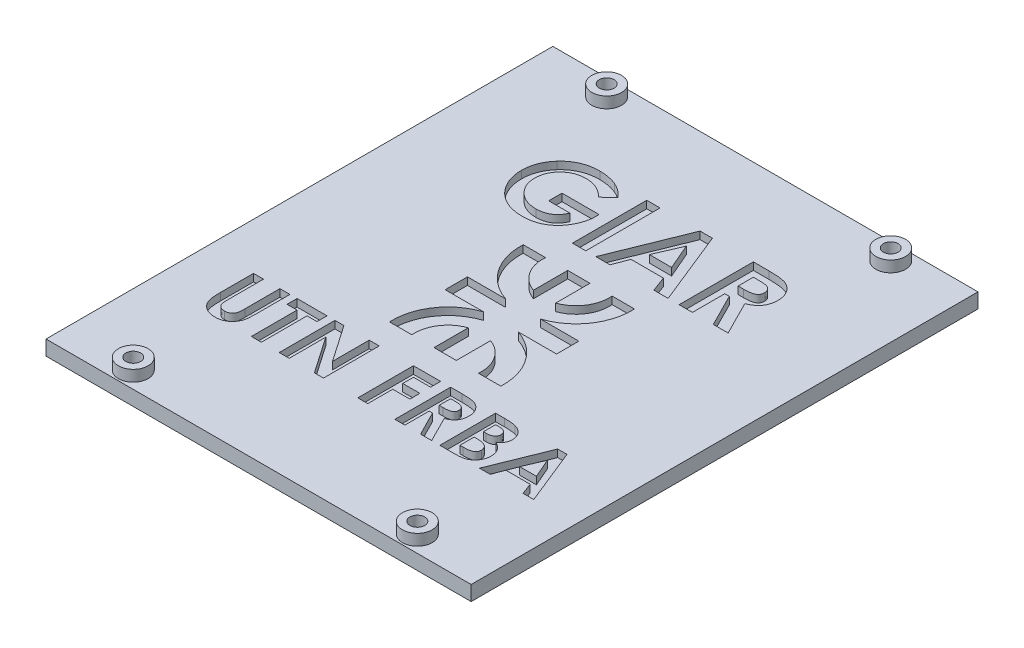
from build123d import *

# Parameters (mm, degrees)
SKETCH2_W           = 114.5
SKETCH2_H           = 136.5
SKETCH2_R           = 2
BOSS_EXTRUDE1_DEPTH = 4
CUT_EXTRUDE1_DEPTH  = 2
SKETCH4_W           = 3.58974359
SKETCH4_H           = 20
CUT_EXTRUDE2_DEPTH  = 2
SKETCH5_R           = 4
SKETCH5_R_2         = 2
BOSS_EXTRUDE2_DEPTH = 3


with BuildPart() as part:
    # Sketch2 → Boss-Extrude1 (new body)
    with BuildSketch(Plane(origin=(0, 0, 0), x_dir=(1, 0, 0), z_dir=(0, 1, 0))):
        Rectangle(SKETCH2_W, SKETCH2_H)
        with Locations(Location((-38.25, 63.75, 0), (0, 0, 270))):
            Circle(SKETCH2_R, mode=Mode.SUBTRACT)
        with Locations(Location((-38.25, -63.75, 0), (0, 0, 90))):
            Circle(SKETCH2_R, mode=Mode.SUBTRACT)
        with Locations(Location((38.25, -63.75, 0), (0, 0, 270))):
            Circle(SKETCH2_R, mode=Mode.SUBTRACT)
        with Locations(Location((38.25, 63.75, 0), (0, 0, 90))):
            Circle(SKETCH2_R, mode=Mode.SUBTRACT)
    extrude(amount=BOSS_EXTRUDE1_DEPTH)

    # Sketch3 → Cut-Extrude1 (cut)
    with BuildSketch(Plane(origin=(0, 4, 0), x_dir=(1, 0, 0), z_dir=(0, 1, 0))):
        with BuildLine():
            Line((-15, -3), (-4.683748499, -3))
            ThreePointArc((-4.683748499, -3), (-12.36640312, -8.760472694), (-14.981238267, -18))
            Line((-14.981238267, -18), (-8.968695557, -18))
            ThreePointArc((-8.968695557, -18), (-7.558771319, -12.364820766), (-3, -8.764718626))
            Line((-3, -8.764718626), (-3, -18))
            Line((-3, -18), (3, -18))
            Line((3, -18), (3, -8.764718626))
            ThreePointArc((3, -8.764718626), (7.558771319, -12.364820766), (8.968695557, -18))
            Line((8.968695557, -18), (14.981238267, -18))
            ThreePointArc((14.981238267, -18), (12.36640312, -8.760472694), (4.683748499, -3))
            Line((4.683748499, -3), (15, -3))
            Line((15, -3), (15, 3))
            Line((15, 3), (4.683748499, 3))
            ThreePointArc((4.683748499, 3), (12.36640312, 8.760472694), (14.981238267, 18))
            Line((14.981238267, 18), (8.968695557, 18))
            ThreePointArc((8.968695557, 18), (7.558771319, 12.364820766), (3, 8.764718626))
            Line((3, 8.764718626), (3, 18))
            Line((3, 18), (-3, 18))
            Line((-3, 18), (-3, 8.764718626))
            ThreePointArc((-3, 8.764718626), (-7.558771319, 12.364820766), (-8.968695557, 18))
            Line((-8.968695557, 18), (-14.981238267, 18))
            ThreePointArc((-14.981238267, 18), (-12.36640312, 8.760472694), (-4.683748499, 3))
            Line((-4.683748499, 3), (-15, 3))
            Line((-15, 3), (-15, -3))
        make_face()
    extrude(amount=-CUT_EXTRUDE1_DEPTH, mode=Mode.SUBTRACT)

    # Sketch4 → Cut-Extrude2 (cut)
    # profile 1 of 11: a face of its own
    with BuildSketch(Plane(origin=(0, 4, 4), x_dir=(1, 0, 0), z_dir=(0, 1, 0))):
        with BuildLine():
            Line((-13.209134615, 45.818910256), (-15.925480769, 43.21875))
            add(Edge.make_bspline(
                [(-15.925480769, 43.21875), (-16.140538634, 43.434065542), (-16.56251767, 43.856550183), (-17.252611595, 44.406442978), (-17.967339464, 44.873960563), (-18.709053733, 45.258386223), (-19.478787615, 45.556580188), (-20.275022094, 45.769887872), (-21.099052543, 45.896404274), (-21.656884374, 45.914116139), (-21.939102564, 45.923076923)],
                knots=[0, 0, 0, 0, 1.075575784, 2.110457258, 3.113929901, 4.09197124, 5.059417775, 6.02750972, 7.002078037, 8, 8, 8, 8], degree=3))
            add(Edge.make_bspline(
                [(-21.939102564, 45.923076923), (-22.183777106, 45.916798142), (-22.664217018, 45.904469206), (-23.370177196, 45.810844105), (-24.04476539, 45.654447585), (-24.691168634, 45.43778632), (-25.305440412, 45.155841537), (-25.891139928, 44.812964722), (-26.444662783, 44.40653284), (-26.961650383, 43.944250426), (-27.432369257, 43.439531365), (-27.843331689, 42.899303498), (-28.193383392, 42.333636215), (-28.481547336, 41.739635478), (-28.700808761, 41.11821296), (-28.857332726, 40.469819783), (-28.956686522, 39.796340266), (-28.968417237, 39.336885564), (-28.974358974, 39.104166667)],
                knots=[0, 0, 0, 0, 1.075001177, 2.110859044, 3.123021556, 4.114053297, 5.101481495, 6.087880186, 7.091499647, 8.114004866, 9.131394192, 10.11971144, 11.092043119, 12.050101265, 13.015322563, 13.981809771, 14.977764287, 16, 16, 16, 16], degree=3))
            add(Edge.make_bspline(
                [(-28.974358974, 39.104166667), (-28.968816806, 38.863393056), (-28.957897976, 38.389036082), (-28.853010267, 37.692896831), (-28.691412693, 37.023160707), (-28.454876933, 36.384796998), (-28.163773046, 35.769061012), (-27.794605356, 35.187880141), (-27.364118887, 34.632379115), (-26.873082857, 34.112229527), (-26.338962464, 33.632776788), (-25.760492701, 33.219188514), (-25.155274163, 32.862351109), (-24.513538596, 32.57974742), (-23.846424631, 32.352847616), (-23.147165815, 32.192863783), (-22.41733671, 32.094714256), (-21.919380892, 32.082912505), (-21.666666667, 32.076923077)],
                knots=[0, 0, 0, 0, 1.022067601, 2.013613092, 2.983553406, 3.943623673, 4.90013463, 5.87121881, 6.861774014, 7.881098904, 8.905697761, 9.905387765, 10.89678721, 11.884561068, 12.87834324, 13.885584958, 14.926927371, 16, 16, 16, 16], degree=3))
            add(Edge.make_bspline(
                [(-21.666666667, 32.076923077), (-21.502285422, 32.07840626), (-21.179568462, 32.08131808), (-20.706197677, 32.128585096), (-20.252822164, 32.19615879), (-19.817686125, 32.285618337), (-19.405183266, 32.412219649), (-19.009602202, 32.560264294), (-18.63326069, 32.734986493), (-18.278199215, 32.942414489), (-17.939133432, 33.174915917), (-17.619237062, 33.440946992), (-17.312898747, 33.734509694), (-17.02369801, 34.059190303), (-16.75652966, 34.417891852), (-16.502834297, 34.804022719), (-16.265516693, 35.221415018), (-16.125291982, 35.516156317), (-16.053685897, 35.666666667)],
                knots=[0, 0, 0, 0, 1.109579412, 2.178351274, 3.208885622, 4.204702371, 5.174744997, 6.119429583, 7.05542196, 7.97267548, 8.893247984, 9.828544973, 10.778894627, 11.756245826, 12.760884819, 13.796418446, 14.874735809, 16, 16, 16, 16], degree=3))
            Line((-16.053685897, 35.666666667), (-21.794871795, 35.666666667))
            Line((-21.794871795, 35.666666667), (-21.794871795, 39.256410256))
            Line((-21.794871795, 39.256410256), (-11.822916667, 39.256410256))
            Line((-11.822916667, 39.256410256), (-11.794871795, 38.403044872))
            add(Edge.make_bspline(
                [(-11.794871795, 38.403044872), (-11.798475352, 38.183878989), (-11.805676036, 37.745938343), (-11.871482733, 37.093919328), (-11.980490525, 36.450547993), (-12.129514611, 35.816470524), (-12.316279489, 35.188576544), (-12.554463172, 34.572878661), (-12.833374809, 33.965201415), (-13.14587551, 33.368126966), (-13.497036385, 32.795217798), (-13.875112629, 32.252748445), (-14.274714507, 31.741657803), (-14.704533196, 31.269066647), (-15.157875711, 30.831005), (-15.635634462, 30.42915814), (-16.139499256, 30.063186054), (-16.666800922, 29.729997114), (-17.22054295, 29.437976667), (-17.797680867, 29.183957618), (-18.397343275, 28.968224603), (-19.021078359, 28.791370462), (-19.667658767, 28.654913422), (-20.337098348, 28.56134465), (-21.029764767, 28.497763619), (-21.499585747, 28.490750183), (-21.738782051, 28.487179487)],
                knots=[0, 0, 0, 0, 1.006889344, 2.011981806, 3.007738725, 4.003571281, 5.003404394, 6.015442001, 7.03424805, 8.074616296, 9.110249922, 10.119753985, 11.111721717, 12.089233633, 13.052717867, 14.006597561, 14.955430184, 15.912305663, 16.870361111, 17.829300583, 18.807640451, 19.796414044, 20.806216501, 21.841577364, 22.90109906, 24, 24, 24, 24], degree=3))
            add(Edge.make_bspline(
                [(-21.738782051, 28.487179487), (-21.99398829, 28.490705616), (-22.499883174, 28.497695454), (-23.247916563, 28.563160047), (-23.974249037, 28.671205132), (-24.679061761, 28.820735838), (-25.363991169, 29.006838746), (-26.027860445, 29.240441918), (-26.669311799, 29.518320278), (-27.290266076, 29.833115501), (-27.882786803, 30.190120704), (-28.445546048, 30.583075759), (-28.975472162, 31.014508365), (-29.477993232, 31.47719625), (-29.941368425, 31.982512324), (-30.382865921, 32.514076841), (-30.781096678, 33.091385468), (-31.153183438, 33.695721691), (-31.483748288, 34.326832259), (-31.772832002, 34.973044458), (-32.019362429, 35.630616715), (-32.21375763, 36.302610909), (-32.371588328, 36.984341331), (-32.484519153, 37.678772671), (-32.548296467, 38.385818001), (-32.558810475, 38.860989088), (-32.564102564, 39.100160256)],
                knots=[0, 0, 0, 0, 1.084149091, 2.14910686, 3.187506334, 4.202448172, 5.208724393, 6.201130722, 7.189831603, 8.176984443, 9.156919086, 10.126598231, 11.090766514, 12.05840148, 13.026036446, 14.001772938, 14.991905635, 16.003017641, 17.015720547, 18.016462227, 19.009322657, 19.99686681, 20.986544154, 21.980959929, 22.983742515, 24, 24, 24, 24], degree=3))
            add(Edge.make_bspline(
                [(-32.564102564, 39.100160256), (-32.557015327, 39.42644084), (-32.543020135, 40.070748258), (-32.41340342, 41.019817171), (-32.211350272, 41.937946648), (-31.921383662, 42.821792922), (-31.549288027, 43.672573502), (-31.10033444, 44.492285636), (-30.564770654, 45.280058041), (-30.1502075, 45.76779857), (-29.939903846, 46.015224359)],
                knots=[0, 0, 0, 0, 1.034044851, 2.041932006, 3.031217818, 4.011390712, 4.986069675, 5.97149666, 6.970960976, 8, 8, 8, 8], degree=3))
            add(Edge.make_bspline(
                [(-29.939903846, 46.015224359), (-29.809328362, 46.158367677), (-29.550137991, 46.442505011), (-29.135822654, 46.837319617), (-28.711000164, 47.208459953), (-28.269786662, 47.548056221), (-27.814501525, 47.863542347), (-27.343834363, 48.149004292), (-26.860254187, 48.413531314), (-26.359989657, 48.643615663), (-25.845659727, 48.849905474), (-25.314986511, 49.02445566), (-24.771944641, 49.179065637), (-24.211725465, 49.296684175), (-23.639988532, 49.394627918), (-23.052675462, 49.460274943), (-22.451386719, 49.50838954), (-22.044705255, 49.511331839), (-21.838942308, 49.512820513)],
                knots=[0, 0, 0, 0, 1.020590567, 2.025856924, 3.013483481, 3.991664875, 4.957826714, 5.930500614, 6.890802512, 7.860442893, 8.829981142, 9.809047939, 10.802672283, 11.803273349, 12.823572789, 13.857849586, 14.916166035, 16, 16, 16, 16], degree=3))
            add(Edge.make_bspline(
                [(-21.838942308, 49.512820513), (-21.623853223, 49.509503469), (-21.195904924, 49.50290377), (-20.559616672, 49.457238161), (-19.932170072, 49.38678689), (-19.316209245, 49.28110596), (-18.709667024, 49.150779378), (-18.115683016, 48.983798769), (-17.530382211, 48.794078719), (-17.149353604, 48.642819879), (-16.959134615, 48.567307692)],
                knots=[0, 0, 0, 0, 1.03180557, 2.052914215, 3.058998889, 4.059601663, 5.049854447, 6.033765722, 7.018406786, 8, 8, 8, 8], degree=3))
            add(Edge.make_bspline(
                [(-16.959134615, 48.567307692), (-16.799088867, 48.497520839), (-16.473560242, 48.355576311), (-15.999956214, 48.095882139), (-15.525195042, 47.807981343), (-15.05439964, 47.481347603), (-14.588287368, 47.116591875), (-14.121991519, 46.719475414), (-13.660272207, 46.285367615), (-13.36146133, 45.976409693), (-13.209134615, 45.818910256)],
                knots=[0, 0, 0, 0, 0.894392155, 1.819168899, 2.76525314, 3.739198753, 4.75366411, 5.797420238, 6.877176959, 8, 8, 8, 8], degree=3))
        make_face()
    # profile 2 of 11: a face of its own
    with BuildSketch(Plane(origin=(0, 4, 4), x_dir=(1, 0, 0), z_dir=(0, 1, 0))):
        with Locations((-6.923076923, 39)):
            Rectangle(SKETCH4_W, SKETCH4_H)
    # profile 3 of 11: a face of its own
    with BuildSketch(Plane(origin=(0, 4, 4), x_dir=(1, 0, 0), z_dir=(0, 1, 0))):
        Polygon((5.645032051, 49), (8.974358974, 49), (17.051282051, 29), (13.217147436, 29), (11.662660256, 33.102564103), (2.948717949, 33.102564103), (1.394230769, 29), (-2.435897436, 29), align=None)
        Polygon((7.307692308, 43.635416667), (4.310897436, 36.692307692), (10.304487179, 36.692307692), align=None, mode=Mode.SUBTRACT)
    # profile 4 of 11: a face of its own
    with BuildSketch(Plane(origin=(0, 4, 4), x_dir=(1, 0, 0), z_dir=(0, 1, 0))):
        with BuildLine():
            Line((20, 49), (24.182692308, 49))
            add(Edge.make_bspline(
                [(24.182692308, 49), (24.459166996, 48.999018674), (24.990905701, 48.997131306), (25.757643869, 48.967353651), (26.461998321, 48.925915599), (27.105011916, 48.862680033), (27.686409563, 48.778837315), (28.206773958, 48.680000625), (28.666089891, 48.567355027), (29.068231057, 48.426989724), (29.431143575, 48.26865979), (29.769428495, 48.086735793), (30.090548888, 47.883243514), (30.392358409, 47.65282852), (30.677479855, 47.399635921), (30.946451123, 47.123410852), (31.195471402, 46.821811039), (31.422998747, 46.496742211), (31.630371606, 46.154777258), (31.813645721, 45.79544666), (31.962684536, 45.418500527), (32.094376305, 45.029386545), (32.18922962, 44.622542253), (32.255198713, 44.201928349), (32.303498702, 43.766064229), (32.306275721, 43.469957497), (32.307692308, 43.318910256)],
                knots=[0, 0, 0, 0, 1.749336639, 3.364467119, 4.854658419, 6.213483162, 7.451590619, 8.570285859, 9.5643256, 10.440900261, 11.26203566, 12.067320669, 12.869050712, 13.665104639, 14.467235401, 15.27997916, 16.102287765, 16.939272006, 17.78853747, 18.631303466, 19.488103222, 20.351255419, 21.228522269, 22.127379805, 23.044756219, 24, 24, 24, 24], degree=3))
            add(Edge.make_bspline(
                [(32.307692308, 43.318910256), (32.304012524, 43.161251636), (32.296797138, 42.852111816), (32.257931147, 42.398010633), (32.186896323, 41.963558385), (32.079303748, 41.550027093), (31.955640059, 41.15226988), (31.791199073, 40.777625613), (31.605611168, 40.420645635), (31.385193836, 40.086379564), (31.143296581, 39.767402681), (30.861975163, 39.475936175), (30.559454887, 39.196314824), (30.218729988, 38.946053162), (29.854819935, 38.708229398), (29.460494218, 38.492697733), (29.038326343, 38.294040198), (28.741521419, 38.183255033), (28.58974359, 38.126602564)],
                knots=[0, 0, 0, 0, 1.099860209, 2.156625411, 3.176576793, 4.16617041, 5.135385252, 6.078461593, 7.016046972, 7.938469504, 8.868247731, 9.803980173, 10.76021508, 11.73834243, 12.748633912, 13.790971185, 14.870363756, 16, 16, 16, 16], degree=3))
            Line((28.58974359, 38.126602564), (33.205128205, 29))
            Line((33.205128205, 29), (29.21474359, 29))
            Line((29.21474359, 29), (24.807692308, 37.717948718))
            Line((24.807692308, 37.717948718), (23.58974359, 37.717948718))
            Line((23.58974359, 37.717948718), (23.58974359, 29))
            Line((23.58974359, 29), (20, 29))
            Line((20, 29), (20, 49))
        make_face()
        with BuildLine():
            Line((23.58974359, 41.307692308), (24.987980769, 41.307692308))
            add(Edge.make_bspline(
                [(24.987980769, 41.307692308), (25.158926887, 41.309617618), (25.486251972, 41.313304173), (25.956988434, 41.330403944), (26.384529407, 41.371605941), (26.770710895, 41.423663125), (27.117476128, 41.483770662), (27.421732084, 41.569908412), (27.688166881, 41.662207191), (27.913623258, 41.776910631), (28.106248006, 41.907353321), (28.272567146, 42.055539459), (28.410136923, 42.227046045), (28.523363867, 42.41721227), (28.611442118, 42.627720107), (28.675732495, 42.856258656), (28.711661308, 43.105431267), (28.71579504, 43.277394297), (28.717948718, 43.366987179)],
                knots=[0, 0, 0, 0, 1.688639943, 3.233382647, 4.650958383, 5.928841754, 7.082724185, 8.122798841, 9.049171256, 9.863274652, 10.613301712, 11.341792392, 12.054588806, 12.776240173, 13.521029143, 14.301969904, 15.115324896, 16, 16, 16, 16], degree=3))
            add(Edge.make_bspline(
                [(28.717948718, 43.366987179), (28.713876992, 43.4729821), (28.705878842, 43.68118948), (28.626512342, 43.980935101), (28.500178018, 44.258370181), (28.327008262, 44.5122412), (28.108923468, 44.73480206), (27.858653961, 44.930991231), (27.57079832, 45.086122947), (27.304265658, 45.188446176), (27.061783235, 45.249667219), (26.842950499, 45.295288599), (26.589540873, 45.327621781), (26.301363046, 45.361916875), (25.979151595, 45.384155508), (25.621150273, 45.400385277), (25.228387258, 45.407025673), (24.954594133, 45.40914849), (24.811698718, 45.41025641)],
                knots=[0, 0, 0, 0, 1.020303359, 2.004196876, 2.966617323, 3.9489082, 4.950758222, 5.960522915, 7.003732012, 8.091992268, 8.70421221, 9.413913587, 10.24622431, 11.166358409, 12.212345909, 13.359657661, 14.621978493, 16, 16, 16, 16], degree=3))
            Line((24.811698718, 45.41025641), (23.58974359, 45.41025641))
            Line((23.58974359, 45.41025641), (23.58974359, 41.307692308))
        make_face(mode=Mode.SUBTRACT)
    # profile 5 of 11: a face of its own
    with BuildSketch(Plane(origin=(0, 4, 4), x_dir=(1, 0, 0), z_dir=(0, 1, 0))):
        with BuildLine():
            Line((-44.615384615, -21), (-41.923076923, -21))
            Line((-41.923076923, -21), (-41.923076923, -30.759615385))
            add(Edge.make_bspline(
                [(-41.923076923, -30.759615385), (-41.922930529, -30.860798844), (-41.922647769, -31.05623365), (-41.908492692, -31.336618611), (-41.895539819, -31.594351096), (-41.872169161, -31.829148944), (-41.837642689, -32.041112593), (-41.804209797, -32.231603621), (-41.758961684, -32.397211503), (-41.690961005, -32.58571663), (-41.586194281, -32.797512436), (-41.415011267, -33.018250884), (-41.217480713, -33.219706757), (-40.980728967, -33.387390993), (-40.714640942, -33.523032425), (-40.420678674, -33.623527716), (-40.099256544, -33.679389754), (-39.877010773, -33.687918117), (-39.762620192, -33.692307692)],
                knots=[0, 0, 0, 0, 1.155499968, 2.231836252, 3.205919964, 4.102923608, 4.924856345, 5.658536265, 6.31071849, 6.882491295, 7.94666036, 8.992281882, 10.060072772, 11.158554251, 12.289267114, 13.461410017, 14.693379945, 16, 16, 16, 16], degree=3))
            add(Edge.make_bspline(
                [(-39.762620192, -33.692307692), (-39.641094317, -33.688761479), (-39.404139435, -33.681846965), (-39.063317559, -33.613973516), (-38.747544159, -33.505895741), (-38.463505233, -33.351641212), (-38.211483447, -33.166740125), (-37.998152286, -32.955894944), (-37.829792117, -32.718685137), (-37.720061222, -32.499841026), (-37.658452729, -32.29841408), (-37.612274094, -32.118446747), (-37.578420046, -31.906103108), (-37.547706541, -31.664699367), (-37.529250091, -31.391735046), (-37.509237079, -31.08940536), (-37.501902125, -30.755641688), (-37.500651935, -30.523235779), (-37.5, -30.402043269)],
                knots=[0, 0, 0, 0, 1.261321664, 2.459363699, 3.594844139, 4.716940403, 5.803436589, 6.833651888, 7.818396249, 8.814403945, 9.360733334, 10.004355033, 10.743453831, 11.592799886, 12.532235708, 13.585170094, 14.740740724, 16, 16, 16, 16], degree=3))
            Line((-37.5, -30.402043269), (-37.5, -21))
            Line((-37.5, -21), (-34.807692308, -21))
            Line((-34.807692308, -21), (-34.807692308, -29.948317308))
            add(Edge.make_bspline(
                [(-34.807692308, -29.948317308), (-34.808066184, -30.129609789), (-34.80878511, -30.478217549), (-34.819825659, -30.979191432), (-34.843328989, -31.436750715), (-34.863069076, -31.851029095), (-34.901272904, -32.22146847), (-34.94107233, -32.549650723), (-34.991800123, -32.834412849), (-35.067280028, -33.158579924), (-35.197535999, -33.531846438), (-35.407525702, -33.961646649), (-35.674094038, -34.382447089), (-35.989164489, -34.789618665), (-36.344907848, -35.167867936), (-36.733436525, -35.499921837), (-37.148577763, -35.78080363), (-37.594669492, -36.003645418), (-38.071332064, -36.177445213), (-38.5832817, -36.294229921), (-39.130169291, -36.373131136), (-39.507914887, -36.380710569), (-39.702524038, -36.384615385)],
                knots=[0, 0, 0, 0, 1.170808336, 2.251350247, 3.235597562, 4.129743112, 4.929140599, 5.639994148, 6.264258765, 6.79612947, 7.788252245, 8.809469599, 9.879094798, 10.999557536, 12.129761673, 13.226370002, 14.293821979, 15.358369427, 16.438775801, 17.562147481, 18.744053101, 20, 20, 20, 20], degree=3))
            add(Edge.make_bspline(
                [(-39.702524038, -36.384615385), (-39.83182623, -36.38243746), (-40.086936802, -36.378140459), (-40.462121652, -36.340252138), (-40.824811509, -36.284418998), (-41.174324884, -36.202964198), (-41.51187487, -36.097739809), (-41.837371789, -35.968215915), (-42.149606016, -35.815114982), (-42.446830332, -35.63984521), (-42.728678977, -35.450321122), (-42.98627409, -35.240225693), (-43.228480123, -35.025096273), (-43.448299844, -34.795879302), (-43.647384297, -34.554981168), (-43.825323466, -34.301855917), (-43.981852993, -34.036526032), (-44.120910292, -33.754208959), (-44.239929768, -33.440555538), (-44.340267658, -33.084408988), (-44.427925199, -32.680187069), (-44.493067112, -32.22697909), (-44.552125152, -31.726278773), (-44.589505635, -31.176781719), (-44.609061049, -30.57847216), (-44.613223498, -30.163676547), (-44.615384615, -29.948317308)],
                knots=[0, 0, 0, 0, 1.001158378, 1.975264943, 2.917723546, 3.841610987, 4.75185031, 5.653588123, 6.552117133, 7.442167995, 8.324307438, 9.179605724, 10.014504199, 10.831958861, 11.636465792, 12.43274043, 13.225645099, 14.020104002, 14.867201867, 15.819789774, 16.883317127, 18.068162734, 19.364263498, 20.787406516, 22.332041935, 24, 24, 24, 24], degree=3))
            Line((-44.615384615, -29.948317308), (-44.615384615, -21))
        make_face()
    # profile 6 of 11: a face of its own
    with BuildSketch(Plane(origin=(0, 4, 4), x_dir=(1, 0, 0), z_dir=(0, 1, 0))):
        Polygon((-32.884615385, -21), (-24.807692308, -21), (-24.807692308, -23.692307692), (-27.5, -23.692307692), (-27.5, -36), (-30.192307692, -36), (-30.192307692, -23.692307692), (-32.884615385, -23.692307692), align=None)
    # profile 7 of 11: a face of its own
    with BuildSketch(Plane(origin=(0, 4, 4), x_dir=(1, 0, 0), z_dir=(0, 1, 0))):
        Polygon((-22.692307692, -21), (-20.267427885, -21), (-13.461538462, -30.870793269), (-13.461538462, -21), (-10.769230769, -21), (-10.769230769, -36), (-13.212139423, -36), (-20, -26.159254808), (-20, -36), (-22.692307692, -36), align=None)
    # profile 8 of 11: a face of its own
    with BuildSketch(Plane(origin=(0, 4, 4), x_dir=(1, 0, 0), z_dir=(0, 1, 0))):
        Polygon((-1.538461538, -21), (5.769230769, -21), (5.769230769, -23.692307692), (1.153846154, -23.692307692), (1.153846154, -26.576923077), (5.769230769, -26.576923077), (5.769230769, -29.269230769), (1.153846154, -29.269230769), (1.153846154, -36), (-1.538461538, -36), align=None)
    # profile 9 of 11: a face of its own
    with BuildSketch(Plane(origin=(0, 4, 4), x_dir=(1, 0, 0), z_dir=(0, 1, 0))):
        with BuildLine():
            Line((8.461538462, -21), (11.598557692, -21))
            add(Edge.make_bspline(
                [(11.598557692, -21), (11.805913709, -21.000735995), (12.204717737, -21.00215152), (12.779771364, -21.024484762), (13.308037202, -21.055563301), (13.790297399, -21.102989976), (14.226345634, -21.165872014), (14.61661893, -21.239999531), (14.961105879, -21.32448373), (15.262711754, -21.429757707), (15.534896143, -21.548505157), (15.788609833, -21.684948155), (16.029450127, -21.837567365), (16.255807268, -22.01037861), (16.469648353, -22.20027306), (16.671376804, -22.407441861), (16.858142013, -22.63364172), (17.028787521, -22.877443342), (17.184317166, -23.133917056), (17.321772752, -23.403415005), (17.433551863, -23.686124605), (17.53232069, -23.977960092), (17.603460676, -24.28309331), (17.652937496, -24.598553738), (17.689162488, -24.925451828), (17.691245252, -25.147531877), (17.692307692, -25.260817308)],
                knots=[0, 0, 0, 0, 1.749336639, 3.364467119, 4.854658419, 6.213483162, 7.451590619, 8.570285859, 9.5643256, 10.440900261, 11.26203566, 12.067320669, 12.869050712, 13.665104639, 14.467235401, 15.27997916, 16.102287765, 16.939272006, 17.78853747, 18.631303466, 19.488103222, 20.351255419, 21.228522269, 22.127379805, 23.044756219, 24, 24, 24, 24], degree=3))
            add(Edge.make_bspline(
                [(17.692307692, -25.260817308), (17.689547854, -25.379061273), (17.684136315, -25.610916138), (17.654986822, -25.951492025), (17.601710704, -26.277331211), (17.521016273, -26.58747968), (17.428268506, -26.88579759), (17.304937766, -27.16678079), (17.165746838, -27.434515774), (17.000433838, -27.685215327), (16.819010897, -27.924447989), (16.608019834, -28.143047869), (16.381129627, -28.352763882), (16.125585952, -28.540460129), (15.852653413, -28.718827951), (15.556909125, -28.8804767), (15.240283219, -29.029469852), (15.017679526, -29.112558725), (14.903846154, -29.155048077)],
                knots=[0, 0, 0, 0, 1.099860209, 2.156625411, 3.176576793, 4.16617041, 5.135385252, 6.078461593, 7.016046972, 7.938469504, 8.868247731, 9.803980173, 10.76021508, 11.73834243, 12.748633912, 13.790971185, 14.870363756, 16, 16, 16, 16], degree=3))
            Line((14.903846154, -29.155048077), (18.365384615, -36))
            Line((18.365384615, -36), (15.372596154, -36))
            Line((15.372596154, -36), (12.067307692, -29.461538462))
            Line((12.067307692, -29.461538462), (11.153846154, -29.461538462))
            Line((11.153846154, -29.461538462), (11.153846154, -36))
            Line((11.153846154, -36), (8.461538462, -36))
            Line((8.461538462, -36), (8.461538462, -21))
        make_face()
        with BuildLine():
            Line((11.153846154, -26.769230769), (12.202524038, -26.769230769))
            add(Edge.make_bspline(
                [(12.202524038, -26.769230769), (12.330733627, -26.767786787), (12.57622744, -26.76502187), (12.929279787, -26.752197042), (13.249935517, -26.721295544), (13.539571633, -26.682252656), (13.799645558, -26.637172003), (14.027837524, -26.572568691), (14.227663622, -26.503344607), (14.396755905, -26.417317026), (14.541224466, -26.319485009), (14.665963821, -26.208345406), (14.769141154, -26.079715466), (14.854061362, -25.937090798), (14.92012005, -25.77920992), (14.968337832, -25.607806008), (14.995284442, -25.42092655), (14.998384741, -25.291954277), (15, -25.224759615)],
                knots=[0, 0, 0, 0, 1.688639943, 3.233382647, 4.650958383, 5.928841754, 7.082724185, 8.122798841, 9.049171256, 9.863274652, 10.613301712, 11.341792392, 12.054588806, 12.776240173, 13.521029143, 14.301969904, 15.115324896, 16, 16, 16, 16], degree=3))
            add(Edge.make_bspline(
                [(15, -25.224759615), (14.996946206, -25.145263425), (14.990947593, -24.98910789), (14.931422718, -24.764298675), (14.836671975, -24.556222365), (14.706794658, -24.3658191), (14.543231063, -24.198898455), (14.355528932, -24.051756577), (14.139637202, -23.935407789), (13.939737705, -23.858665368), (13.757875888, -23.812749586), (13.593751336, -23.778533551), (13.403694116, -23.754283665), (13.187560746, -23.728562344), (12.945902158, -23.711883369), (12.677401166, -23.699711042), (12.382828905, -23.694730746), (12.177484061, -23.693138632), (12.0703125, -23.692307692)],
                knots=[0, 0, 0, 0, 1.020303359, 2.004196876, 2.966617323, 3.9489082, 4.950758222, 5.960522915, 7.003732012, 8.091992268, 8.70421221, 9.413913587, 10.24622431, 11.166358409, 12.212345909, 13.359657661, 14.621978493, 16, 16, 16, 16], degree=3))
            Line((12.0703125, -23.692307692), (11.153846154, -23.692307692))
            Line((11.153846154, -23.692307692), (11.153846154, -26.769230769))
        make_face(mode=Mode.SUBTRACT)
    # profile 10 of 11: a face of its own
    with BuildSketch(Plane(origin=(0, 4, 4), x_dir=(1, 0, 0), z_dir=(0, 1, 0))):
        with BuildLine():
            Line((20.576923077, -36), (20.576923077, -21))
            Line((20.576923077, -21), (22.980769231, -21))
            add(Edge.make_bspline(
                [(22.980769231, -21), (23.149053492, -20.999980795), (23.474680347, -20.999943633), (23.944474919, -21.016441275), (24.380169708, -21.037782825), (24.780378166, -21.061659056), (25.145781476, -21.102802572), (25.47582398, -21.146163344), (25.771165108, -21.198453762), (25.953758479, -21.245359888), (26.039663462, -21.267427885)],
                knots=[0, 0, 0, 0, 1.311965854, 2.538629056, 3.664479157, 4.713267157, 5.663616078, 6.530575999, 7.308677837, 8, 8, 8, 8], degree=3))
            add(Edge.make_bspline(
                [(26.039663462, -21.267427885), (26.152465426, -21.298555187), (26.373819093, -21.359636947), (26.690868184, -21.482994202), (26.991633472, -21.620114536), (27.275747731, -21.776543192), (27.541466388, -21.954168702), (27.78777962, -22.154400755), (28.019999794, -22.369202046), (28.229881302, -22.604559024), (28.419579605, -22.85325727), (28.584393419, -23.115231616), (28.7275955, -23.386476304), (28.842194673, -23.670404769), (28.928542997, -23.965709443), (28.991697801, -24.271129329), (29.032630666, -24.587630851), (29.036498285, -24.802957181), (29.038461538, -24.912259615)],
                knots=[0, 0, 0, 0, 1.099996261, 2.158545794, 3.195537121, 4.207578794, 5.205712374, 6.197378256, 7.190519799, 8.17788031, 9.159561366, 10.129234751, 11.085776129, 12.040971148, 13.00380137, 13.975669004, 14.972423361, 16, 16, 16, 16], degree=3))
            add(Edge.make_bspline(
                [(29.038461538, -24.912259615), (29.033328214, -25.052684554), (29.023223895, -25.329093792), (28.95867682, -25.735088953), (28.837640998, -26.118812736), (28.679268568, -26.487337025), (28.463931577, -26.839287221), (28.190495245, -27.174495982), (27.863388345, -27.503284889), (27.612479295, -27.70037166), (27.481971154, -27.802884615)],
                knots=[0, 0, 0, 0, 0.986156485, 1.941127874, 2.875419072, 3.804401753, 4.751181392, 5.761612777, 6.835722519, 8, 8, 8, 8], degree=3))
            add(Edge.make_bspline(
                [(27.481971154, -27.802884615), (27.587728691, -27.856872921), (27.795089961, -27.962729051), (28.089482045, -28.136724929), (28.36205698, -28.321791613), (28.614036909, -28.514205486), (28.840136263, -28.722123251), (29.049691067, -28.933564402), (29.232362972, -29.160643636), (29.395713695, -29.395267418), (29.537695488, -29.640833127), (29.661345974, -29.896926058), (29.765789104, -30.16442108), (29.854234248, -30.441956859), (29.92019666, -30.73048799), (29.963205555, -31.030117663), (29.996135853, -31.339823988), (29.998697521, -31.550788203), (30, -31.658052885)],
                knots=[0, 0, 0, 0, 1.164658916, 2.283573913, 3.35186032, 4.395461096, 5.390182219, 6.362969632, 7.312859996, 8.245001507, 9.165155236, 10.092416118, 11.032087915, 11.979892451, 12.947605196, 13.931445124, 14.948243989, 16, 16, 16, 16], degree=3))
            add(Edge.make_bspline(
                [(30, -31.658052885), (29.991547781, -31.862922294), (29.974867362, -32.267231252), (29.852908273, -32.860849658), (29.641469964, -33.423653748), (29.357551916, -33.953406698), (29.007710255, -34.434773029), (28.605492667, -34.856445757), (28.154948562, -35.213382359), (27.73926717, -35.454286875), (27.379735501, -35.615956333), (27.081942137, -35.715910587), (26.762118377, -35.808508057), (26.414405816, -35.873531912), (26.04510801, -35.933048895), (25.650624281, -35.969795913), (25.231691913, -35.994698461), (24.943951054, -35.998197093), (24.795673077, -36)],
                knots=[0, 0, 0, 0, 1.284142165, 2.534249414, 3.780121997, 5.041676246, 6.291546858, 7.49970053, 8.684500223, 9.883330709, 10.50184324, 11.153274765, 11.851151195, 12.587658647, 13.369265475, 14.195992086, 15.070362669, 16, 16, 16, 16], degree=3))
            Line((24.795673077, -36), (20.576923077, -36))
        make_face()
        with BuildLine():
            Line((23.269230769, -23.692307692), (23.269230769, -26.961538462))
            Line((23.269230769, -26.961538462), (23.984375, -26.961538462))
            add(Edge.make_bspline(
                [(23.984375, -26.961538462), (24.081569526, -26.960690888), (24.269197677, -26.9590547), (24.540206639, -26.937981161), (24.792201206, -26.902028394), (25.02422562, -26.851865239), (25.23844127, -26.788165347), (25.433479686, -26.711520659), (25.608483319, -26.618005808), (25.811797064, -26.478711311), (26.026714355, -26.273733222), (26.215903628, -25.977599904), (26.327334847, -25.637047714), (26.33974528, -25.39686394), (26.346153846, -25.272836538)],
                knots=[0, 0, 0, 0, 1.065314748, 2.056525647, 2.977365736, 3.853934255, 4.656397591, 5.425096493, 6.14721249, 6.826394842, 8.123232004, 9.372140726, 10.643011755, 12, 12, 12, 12], degree=3))
            add(Edge.make_bspline(
                [(26.346153846, -25.272836538), (26.34102582, -25.15666427), (26.331110987, -24.932049857), (26.218914076, -24.616671218), (26.044650093, -24.337181197), (25.838906968, -24.145893135), (25.645159836, -24.015249028), (25.479261652, -23.929225447), (25.297175938, -23.852218016), (25.09537771, -23.793336258), (24.875019345, -23.749153459), (24.637171248, -23.716706485), (24.381423048, -23.694621695), (24.204777223, -23.693095571), (24.113581731, -23.692307692)],
                knots=[0, 0, 0, 0, 1.347982417, 2.606269829, 3.849316587, 5.153353503, 5.842674298, 6.568177932, 7.326619318, 8.142485038, 9.012069166, 9.942760135, 10.937925643, 12, 12, 12, 12], degree=3))
            Line((24.113581731, -23.692307692), (23.269230769, -23.692307692))
        make_face(mode=Mode.SUBTRACT)
        with BuildLine():
            Line((23.269230769, -29.461538462), (23.269230769, -33.307692308))
            Line((23.269230769, -33.307692308), (24.044471154, -33.307692308))
            add(Edge.make_bspline(
                [(24.044471154, -33.307692308), (24.197737165, -33.306816705), (24.492410196, -33.305133249), (24.914528792, -33.284793096), (25.298340125, -33.248133554), (25.64282724, -33.20236707), (25.948517785, -33.140360642), (26.214378452, -33.061527415), (26.444055176, -32.974797135), (26.636170804, -32.867674941), (26.793118266, -32.743011272), (26.934746895, -32.615602007), (27.050222054, -32.468623383), (27.141588155, -32.308384785), (27.220665354, -32.138866655), (27.268359136, -31.953449371), (27.304671508, -31.757628257), (27.306669875, -31.622183028), (27.307692308, -31.552884615)],
                knots=[0, 0, 0, 0, 1.753078804, 3.370512758, 4.83203934, 6.162291463, 7.344201807, 8.395507345, 9.331626367, 10.147333109, 10.898971645, 11.62040215, 12.321813352, 13.025280112, 13.727906689, 14.453419512, 15.208716525, 16, 16, 16, 16], degree=3))
            add(Edge.make_bspline(
                [(27.307692308, -31.552884615), (27.30543755, -31.473640791), (27.301045888, -31.319295139), (27.26517913, -31.093702497), (27.199997516, -30.883096797), (27.117898093, -30.682092567), (27.003652383, -30.497886461), (26.867875261, -30.324103801), (26.703821836, -30.166629407), (26.519334189, -30.015938637), (26.304147615, -29.884000704), (26.058161153, -29.769521177), (25.780038471, -29.673912092), (25.468918056, -29.597788076), (25.126163834, -29.533182675), (24.749274077, -29.494606119), (24.341387653, -29.465915039), (24.058552568, -29.46303047), (23.912259615, -29.461538462)],
                knots=[0, 0, 0, 0, 0.845221588, 1.646264278, 2.427170338, 3.19324141, 3.95557735, 4.731569926, 5.540061037, 6.376114724, 7.268642756, 8.224665384, 9.265483498, 10.400594375, 11.639216012, 12.983232105, 14.439614077, 16, 16, 16, 16], degree=3))
            Line((23.912259615, -29.461538462), (23.269230769, -29.461538462))
        make_face(mode=Mode.SUBTRACT)
    # profile 11 of 11: a face of its own
    with BuildSketch(Plane(origin=(0, 4, 4), x_dir=(1, 0, 0), z_dir=(0, 1, 0))):
        Polygon((37.310697115, -21), (39.807692308, -21), (45.865384615, -36), (42.989783654, -36), (41.823918269, -32.923076923), (35.288461538, -32.923076923), (34.122596154, -36), (31.25, -36), align=None)
        Polygon((38.557692308, -25.0234375), (36.310096154, -30.230769231), (40.805288462, -30.230769231), align=None, mode=Mode.SUBTRACT)
    extrude(amount=-CUT_EXTRUDE2_DEPTH, mode=Mode.SUBTRACT)

    # Sketch5 → Boss-Extrude2 (add)
    # profile 1 of 4: a face of its own
    with BuildSketch(Plane(origin=(0, 4, 0), x_dir=(1, 0, 0), z_dir=(0, 1, 0))):
        with Locations(Location((38.25, -63.75, 0), (0, 0, 270))):
            Circle(SKETCH5_R)
        with Locations(Location((38.25, -63.75, 0), (0, 0, 270))):
            Circle(SKETCH5_R_2, mode=Mode.SUBTRACT)
    # profile 2 of 4: a face of its own
    with BuildSketch(Plane(origin=(0, 4, 0), x_dir=(1, 0, 0), z_dir=(0, 1, 0))):
        with Locations(Location((-38.25, -63.75, 0), (0, 0, 270))):
            Circle(SKETCH5_R)
        with Locations(Location((-38.25, -63.75, 0), (0, 0, 90))):
            Circle(SKETCH5_R_2, mode=Mode.SUBTRACT)
    # profile 3 of 4: a face of its own
    with BuildSketch(Plane(origin=(0, 4, 0), x_dir=(1, 0, 0), z_dir=(0, 1, 0))):
        with Locations(Location((38.25, 63.75, 0), (0, 0, 270))):
            Circle(SKETCH5_R)
        with Locations(Location((38.25, 63.75, 0), (0, 0, 90))):
            Circle(SKETCH5_R_2, mode=Mode.SUBTRACT)
    # profile 4 of 4: a face of its own
    with BuildSketch(Plane(origin=(0, 4, 0), x_dir=(1, 0, 0), z_dir=(0, 1, 0))):
        with Locations(Location((-38.25, 63.75, 0), (0, 0, 270))):
            Circle(SKETCH5_R)
        with Locations(Location((-38.25, 63.75, 0), (0, 0, 270))):
            Circle(SKETCH5_R_2, mode=Mode.SUBTRACT)
    extrude(amount=BOSS_EXTRUDE2_DEPTH)


solid = part.part
